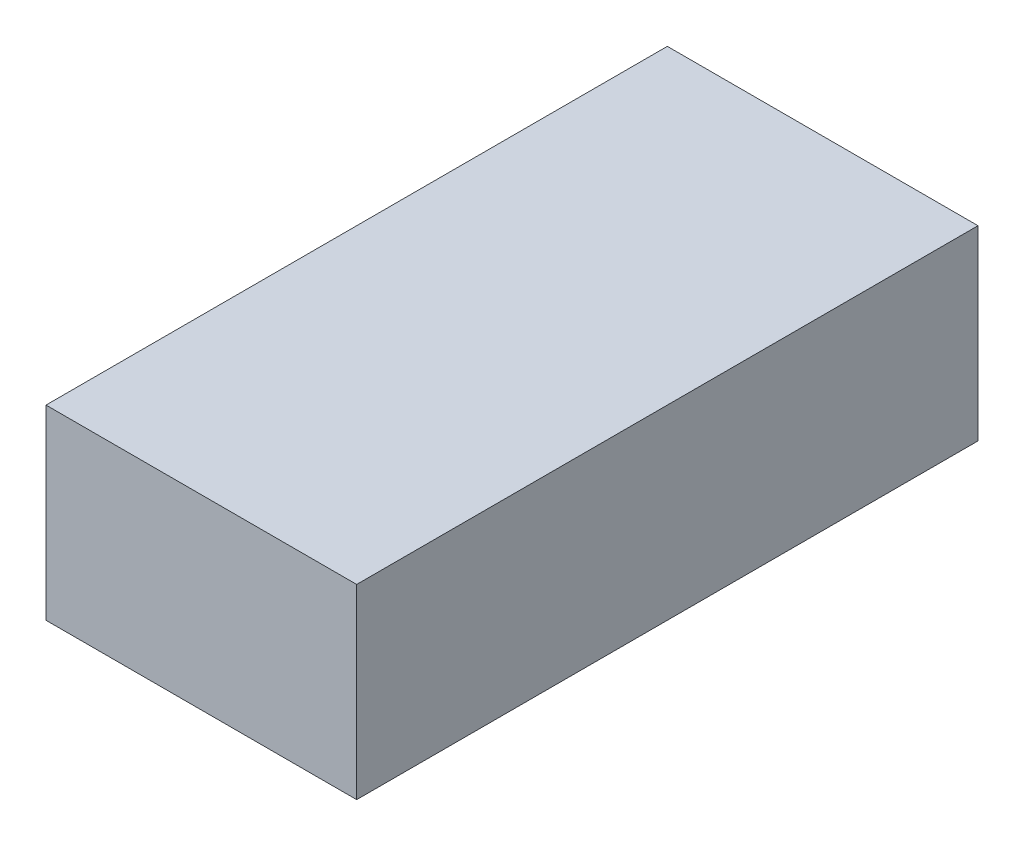
from build123d import *

# Parameters (mm, degrees)
CROQUIS1_W              = 25
CROQUIS1_H              = 15
SALIENTE_EXTRUIR1_DEPTH = 50


with BuildPart() as part:
    # Croquis1 → Saliente-Extruir1 (new body)
    with BuildSketch(Plane.XY):
        Rectangle(CROQUIS1_W, CROQUIS1_H)
    extrude(amount=SALIENTE_EXTRUIR1_DEPTH)


solid = part.part
